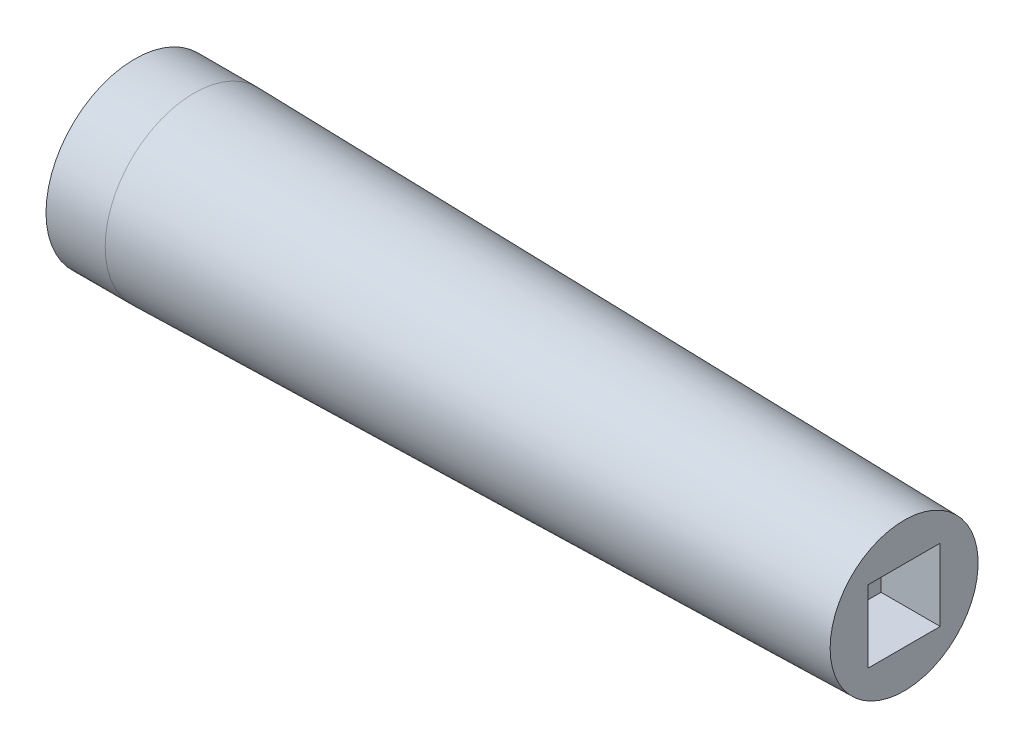
from build123d import *

# Parameters (mm, degrees)
SKETCH2_W          = 15.49
SKETCH2_H          = 15.49
CUT_EXTRUDE1_DEPTH = 12.7


with BuildPart() as part:
    # Sketch1 → Revolve1 (revolve)
    with BuildSketch(Plane(origin=(0, 0, 0), x_dir=(1, 0, 0), z_dir=(0, 1, 0)), mode=Mode.PRIVATE) as revolve1_sk:
        Polygon((0, 0), (165.1, 0), (165.1, 15.88), (12.7, 19.05), (0, 19.05), align=None)
    revolve(revolve1_sk.sketch.rotate(Axis((0, 0, 0), (1, 0, 0)), 180), axis=Axis((0, 0, 0), (1, 0, 0)))

    # Sketch2 → Cut-Extrude1 (cut)
    with BuildSketch(Plane(origin=(165.1, 0, 0), x_dir=(0, 0, -1), z_dir=(1, 0, 0))):
        Rectangle(SKETCH2_W, SKETCH2_H)
    extrude(amount=-CUT_EXTRUDE1_DEPTH, mode=Mode.SUBTRACT)


solid = part.part
